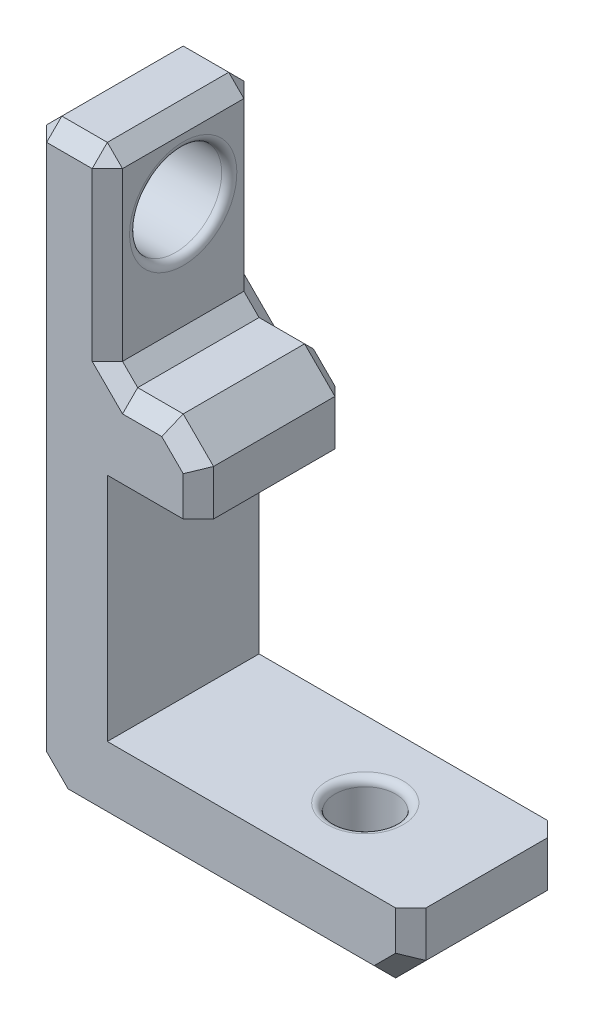
from build123d import *

# Parameters (mm, degrees)
RESSALTO_EXTRUS_O1_DEPTH = 10
ESBO_O3_R                = 2
CORTE_EXTRUS_O1_DEPTH    = 15
CHANFRO1_SIZE            = 1.6
FILETE1_R                = 0.5
CHANFRO5_SIZE            = 2
ESBO_O4_R                = 3.035
CORTE_EXTRUS_O2_DEPTH    = 10
FILETE2_R                = 0.5
CHANFRO6_SIZE            = 1
ESBO_O6_R                = 0.9
CORTE_EXTRUS_O3_DEPTH    = 3.5


with BuildPart() as part:
    # Esboço1 → Ressalto-extrusão1 (new body)
    with BuildSketch(Plane.XY):
        Polygon((-0.113617837, 14.25), (-6.113617837, 14.25), (-6.113617837, -0.95), (13.886382163, -0.95), (13.886382163, -5.95), (-11.113617837, -5.95), (-11.113617837, 32.25), (-6.113617837, 32.25), (-6.113617837, 19.25), (-0.113617837, 19.25), align=None)
    extrude(amount=RESSALTO_EXTRUS_O1_DEPTH)

    # Esboço3 → Corte-extrusão1 (cut)
    with BuildSketch(Plane.XZ.offset(5.95)):
        with Locations(Location((5.886382163, 5, 0), (0, 0, 270))):
            Circle(ESBO_O3_R)
    extrude(amount=-CORTE_EXTRUS_O1_DEPTH, mode=Mode.SUBTRACT)

    # Chanfro1
    chanfro1_edges = [part.edges().sort_by_distance(p)[0] for p in [
        (5.886382163, -5.95, 7),
    ]]
    chamfer(chanfro1_edges, length=CHANFRO1_SIZE)

    # Filete1
    filete1_edges = [part.edges().sort_by_distance(p)[0] for p in [
        (5.886382163, -0.95, 7),
    ]]
    fillet(filete1_edges, radius=FILETE1_R)

    # Chanfro5
    chanfro5_edges = [part.edges().sort_by_distance(p)[0] for p in [
        (13.886382163, -5.95, 5),
        (-11.113617837, -5.95, 5),
        (-0.113617837, 19.25, 5),
    ]]
    chamfer(chanfro5_edges, length=CHANFRO5_SIZE)

    # Esboço4 → Corte-extrusão2 (cut)
    with BuildSketch(Plane(origin=(-6.113617837, 0, 0), x_dir=(0, 0, -1), z_dir=(1, 0, 0))):
        with Locations(Location((-5, 27.25, 0), (0, 0, 90))):
            Circle(ESBO_O4_R)
    extrude(amount=-CORTE_EXTRUS_O2_DEPTH, mode=Mode.SUBTRACT)

    # Filete2
    filete2_edges = [part.edges().sort_by_distance(p)[0] for p in [
        (-11.113617837, 24.215, 5),
        (-6.113617837, 24.215, 5),
    ]]
    fillet(filete2_edges, radius=FILETE2_R)

    # Chanfro6
    chanfro6_edges = [part.edges().sort_by_distance(p)[0] for p in [
        (-11.113617837, 14.15, 0),
        (-8.613617837, 32.25, 0),
        (-6.113617837, 25.75, 10),
        (-6.113617837, 25.75, 0),
        (-0.113617837, 15.75, 0),
        (-8.613617837, 32.25, 10),
        (-11.113617837, 32.25, 5),
        (-6.113617837, 32.25, 5),
        (-6.113617837, 19.25, 5),
        (-11.113617837, 14.15, 10),
        (-4.113617837, 19.25, 0),
        (-4.113617837, 19.25, 10),
        (13.886382163, -2.45, 0),
        (1.386382163, -5.95, 0),
        (12.886382163, -4.95, 0),
        (-10.113617837, -4.95, 0),
        (-1.113617837, 18.25, 0),
        (1.386382163, -5.95, 10),
        (-0.113617837, 15.75, 10),
        (13.886382163, -2.45, 10),
        (12.886382163, -4.95, 10),
        (-10.113617837, -4.95, 10),
        (-1.113617837, 18.25, 10),
    ]]
    chamfer(chanfro6_edges, length=CHANFRO6_SIZE)

    # Esboço6 → Corte-extrusão3 (cut)
    with BuildSketch(Plane.ZY.offset(11.113617837)):
        with Locations(Location((5, 6.65, 0), (0, 0, 270))):
            Circle(ESBO_O6_R)
        with Locations(Location((5, 14.65, 0), (0, 0, 270))):
            Circle(ESBO_O6_R)
    extrude(amount=-CORTE_EXTRUS_O3_DEPTH, mode=Mode.SUBTRACT)


solid = part.part
